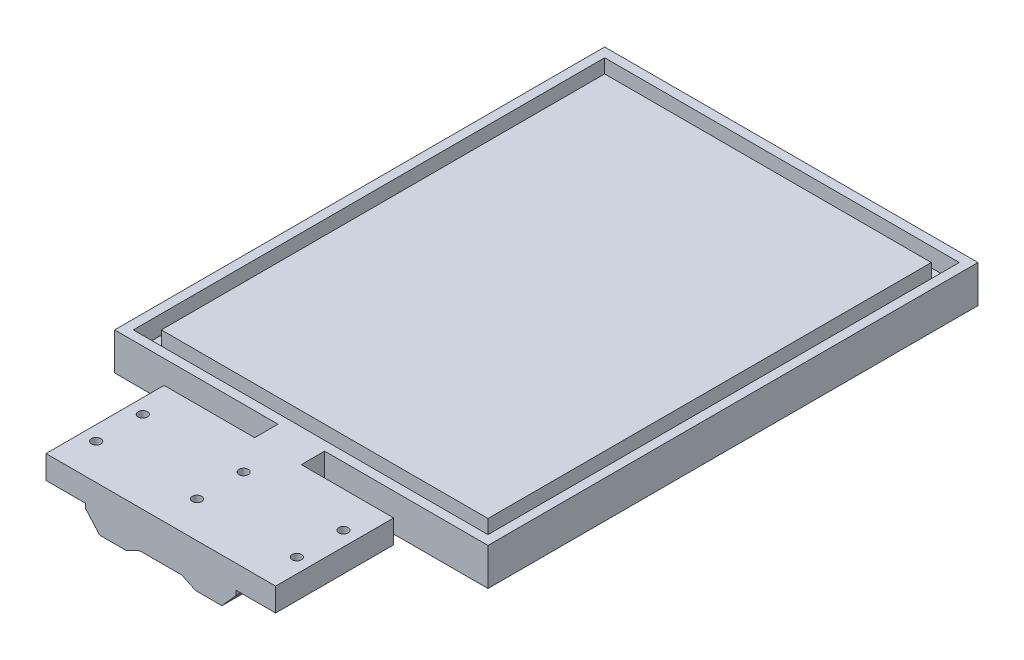
from build123d import *

# Parameters (mm, degrees)
BOSS_EXTRUDE2_DEPTH = 25.3
SKETCH3_R           = 1
CUT_EXTRUDE1_DEPTH  = 37.183559803
SKETCH4_R           = 1
CUT_EXTRUDE2_DEPTH  = 36.640566774
SKETCH5_R           = 2.6
CUT_EXTRUDE3_DEPTH  = 2
SKETCH7_W           = 10
SKETCH7_H           = 8
BOSS_EXTRUDE4_DEPTH = 5
SKETCH8_W           = 80
SKETCH8_H           = 8
BOSS_EXTRUDE5_DEPTH = 105
SKETCH9_W           = 76
SKETCH9_H           = 101
SKETCH9_W_2         = 70
SKETCH9_H_2         = 95
CUT_EXTRUDE4_DEPTH  = 4


with BuildPart() as part:
    # Sketch2 → Boss-Extrude2 (new body)
    with BuildSketch(Plane.XY):
        Polygon((4.5, 3.4), (-4.5, 3.4), (-7.5, 2), (-13.1, 2), (-16.1, 5.4), (-16.1, 6.4), (-24.6, 6.4), (-24.6, 11.4), (24.6, 11.4), (24.6, 6.4), (16.1, 6.4), (16.1, 5.4), (13.1, 2), (7.5, 2), align=None)
    extrude(amount=BOSS_EXTRUDE2_DEPTH)

    # Sketch3 → Cut-Extrude1 (cut, through all)
    with BuildSketch(Plane.XZ.offset(-3.4)):
        with Locations(Location((0, 17.55, 0), (0, 0, 270))):
            Circle(SKETCH3_R)
        with Locations(Location((0, 7.55, 0), (0, 0, 90))):
            Circle(SKETCH3_R)
    extrude(amount=-CUT_EXTRUDE1_DEPTH, mode=Mode.SUBTRACT)

    # Sketch4 → Cut-Extrude2 (cut, through all)
    with BuildSketch(Plane.XZ.offset(-6.4)):
        with Locations(Location((-21.5, 17.65, 0), (0, 0, 270))):
            Circle(SKETCH4_R)
        with Locations(Location((21.5, 17.65, 0), (0, 0, 90))):
            Circle(SKETCH4_R)
        with Locations(Location((-21.5, 7.65, 0), (0, 0, 270))):
            Circle(SKETCH4_R)
        with Locations(Location((21.5, 7.65, 0), (0, 0, 90))):
            Circle(SKETCH4_R)
    extrude(amount=-CUT_EXTRUDE2_DEPTH, mode=Mode.SUBTRACT)

    # Sketch5 → Cut-Extrude3 (cut)
    with BuildSketch(Plane.XZ.offset(-6.4)):
        with Locations(Location((-21.5, 17.65, 0), (0, 0, 270))):
            Circle(SKETCH5_R)
        with Locations(Location((-21.5, 7.45, 0), (0, 0, 90))):
            Circle(SKETCH5_R)
        with Locations(Location((21.5, 7.45, 0), (0, 0, 270))):
            Circle(SKETCH5_R)
        with Locations(Location((21.5, 17.65, 0), (0, 0, 90))):
            Circle(SKETCH5_R)
    extrude(amount=-CUT_EXTRUDE3_DEPTH, mode=Mode.SUBTRACT)

    # Sketch7 → Boss-Extrude4 (add)
    with BuildSketch(Plane(origin=(0, 0, 0), x_dir=(-1, 0, 0), z_dir=(0, 0, -1))):
        with Locations((0.191701822, 7.4)):
            Rectangle(SKETCH7_W, SKETCH7_H)
    extrude(amount=BOSS_EXTRUDE4_DEPTH)

    # Sketch8 → Boss-Extrude5 (add)
    with BuildSketch(Plane(origin=(0, 0, -5), x_dir=(-1, 0, 0), z_dir=(0, 0, -1))):
        with Locations((0.191701822, 7.4)):
            Rectangle(SKETCH8_W, SKETCH8_H)
    extrude(amount=BOSS_EXTRUDE5_DEPTH)

    # Sketch9 → Cut-Extrude4 (cut)
    with BuildSketch(Plane(origin=(0, 11.4, 0), x_dir=(1, 0, 0), z_dir=(0, 1, 0))):
        with Locations((-0.191701822, 57.5)):
            Rectangle(SKETCH9_W, SKETCH9_H)
        with Locations((-0.191701822, 57.5)):
            Rectangle(SKETCH9_W_2, SKETCH9_H_2, mode=Mode.SUBTRACT)
    extrude(amount=-CUT_EXTRUDE4_DEPTH, mode=Mode.SUBTRACT)


solid = part.part
